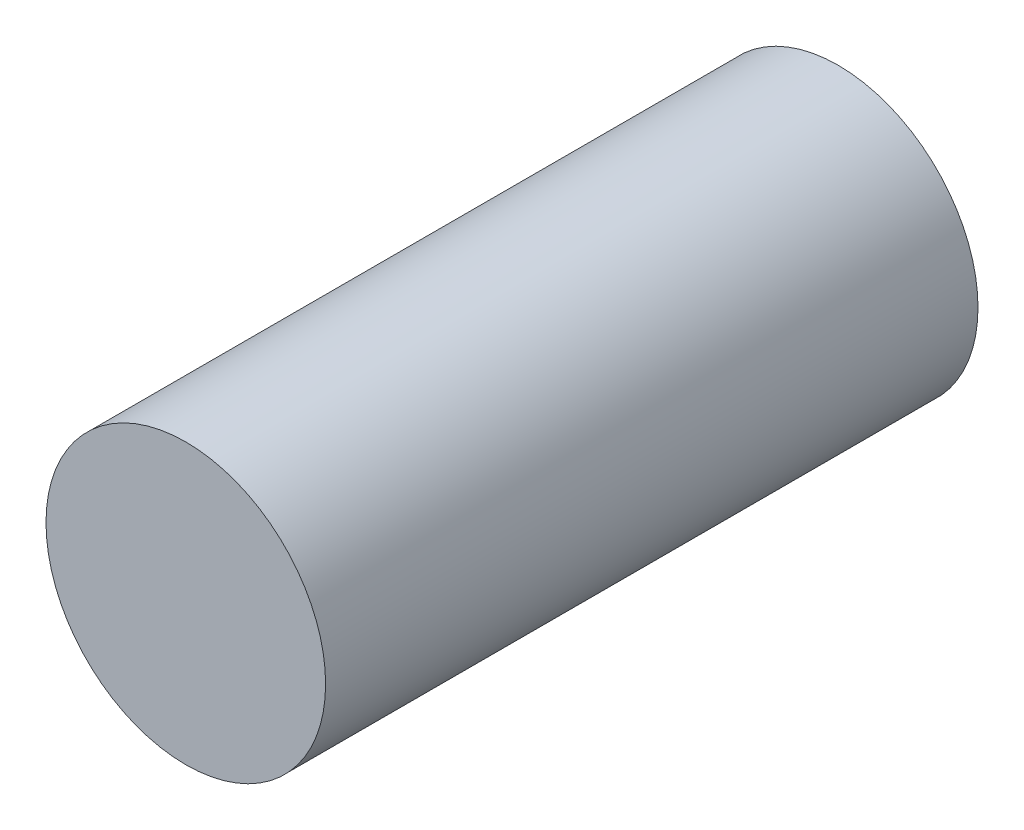
from build123d import *

# Parameters (mm, degrees)
SKETCH1_R           = 1.5
BOSS_EXTRUDE1_DEPTH = 7


with BuildPart() as part:
    # Sketch1 → Boss-Extrude1 (new body)
    with BuildSketch(Plane.XY):
        Circle(SKETCH1_R)
    extrude(amount=BOSS_EXTRUDE1_DEPTH)


solid = part.part
